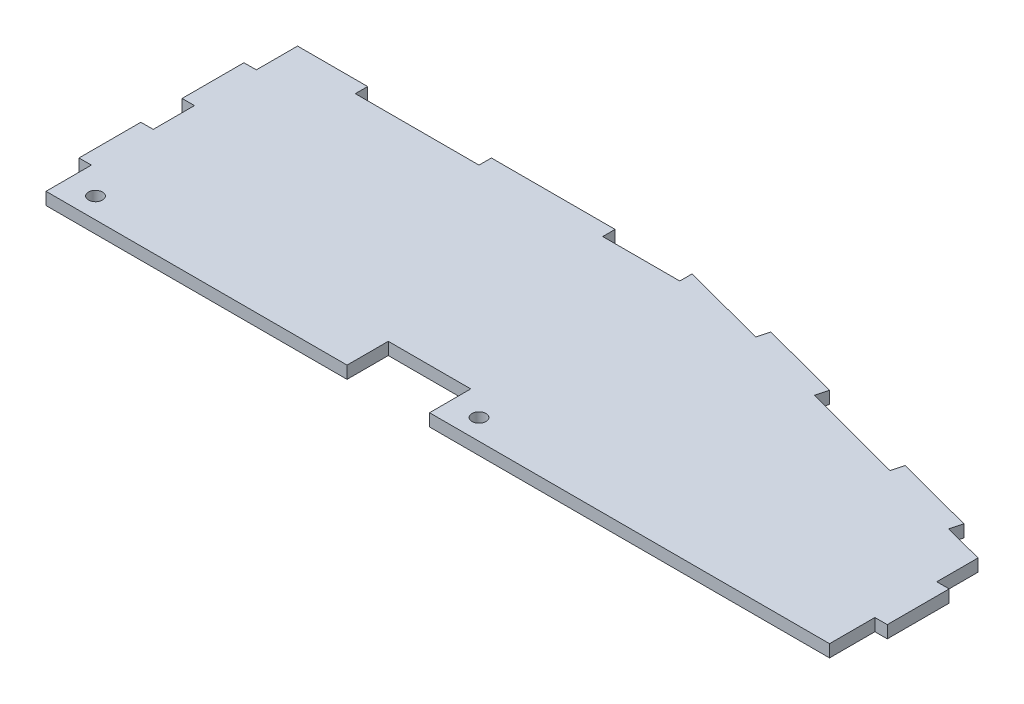
from build123d import *

# Parameters (mm, degrees)
SKETCH1_W           = 196
SKETCH1_H           = 61
BOSS_EXTRUDE1_DEPTH = 3
SKETCH2_R           = 1.7
SKETCH2_W           = 3
SKETCH2_H           = 10
SKETCH2_H_2         = 11
SKETCH2_W_2         = 30
SKETCH2_H_3         = 3
SKETCH2_W_3         = 20
CUT_EXTRUDE1_DEPTH  = 3
CUT_EXTRUDE2_DEPTH  = 10
BOSS_EXTRUDE2_DEPTH = 3


with BuildPart() as part:
    # Sketch1 → Boss-Extrude1 (new body)
    with BuildSketch(Plane(origin=(0, 0, 0), x_dir=(1, 0, 0), z_dir=(0, 1, 0))):
        Rectangle(SKETCH1_W, SKETCH1_H)
    extrude(amount=BOSS_EXTRUDE1_DEPTH)

    # Sketch2 → Cut-Extrude1 (cut)
    with BuildSketch(Plane(origin=(0, 3, 0), x_dir=(1, 0, 0), z_dir=(0, 1, 0))):
        with Locations(Location((-88, -25.5, 0), (0, 0, 270))):
            Circle(SKETCH2_R)
        with Locations(Location((5, -25.5, 0), (0, 0, 270))):
            Circle(SKETCH2_R)
        with Locations((-96.5, 25.5)):
            Rectangle(SKETCH2_W, SKETCH2_H)
        with Locations((-96.5, 0.5)):
            Rectangle(SKETCH2_W, SKETCH2_H)
        with Locations((-96.5, -25)):
            Rectangle(SKETCH2_W, SKETCH2_H_2)
        with Locations((96.5, 0.5)):
            Rectangle(SKETCH2_W, SKETCH2_H)
        with Locations((96.5, -25)):
            Rectangle(SKETCH2_W, SKETCH2_H_2)
        with Locations((57, 29)):
            Rectangle(SKETCH2_W_2, SKETCH2_H_3)
        with Locations((-12, -25.5)):
            Rectangle(SKETCH2_W_3, SKETCH2_H)
        with Locations((-63, 29)):
            Rectangle(SKETCH2_W_2, SKETCH2_H_3)
        with Locations((-3, 29)):
            Rectangle(SKETCH2_W_2, SKETCH2_H_3)
        with Locations((96.5, 25.5)):
            Rectangle(SKETCH2_W, SKETCH2_H)
    extrude(amount=-CUT_EXTRUDE1_DEPTH, mode=Mode.SUBTRACT)

    # Sketch3 → Cut-Extrude2 (cut)
    with BuildSketch(Plane(origin=(0, 3, 0), x_dir=(1, 0, 0), z_dir=(0, 1, 0))):
        Polygon((12, 30.5), (98, 30.5), (98, 5.5), (95, 5.5), (85.333795578, 8.062126473), (86.10243352, 10.9619878), (66.770024675, 16.086240747), (66.001386733, 13.18637942), (40.998613267, 19.81362058), (41.767251209, 22.713481907), (22.434842364, 27.837734853), (21.666204422, 24.937873527), (12, 27.5), align=None)
    extrude(amount=-CUT_EXTRUDE2_DEPTH, mode=Mode.SUBTRACT)

    # Sketch4 → Boss-Extrude2 (add)
    with BuildSketch(Plane(origin=(0, 3, 0), x_dir=(1, 0, 0), z_dir=(0, 1, 0))):
        Polygon((12, 27.5), (0.681818182, 30.5), (0.681818182, 27.5), align=None)
    extrude(amount=-BOSS_EXTRUDE2_DEPTH)


solid = part.part
